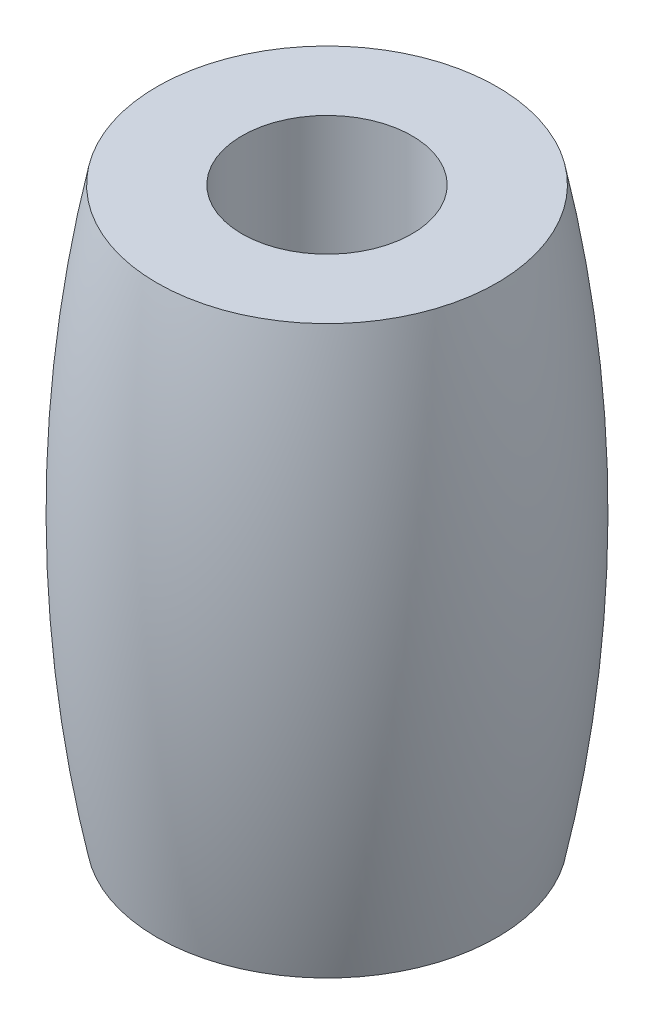
from build123d import *

# Parameters (mm, degrees)
SKETCH3_R          = 1.5
CUT_EXTRUDE1_DEPTH = 12.161159952


with BuildPart() as part:
    # Sketch2 → Revolve1 (revolve)
    with BuildSketch(Plane.XY, mode=Mode.PRIVATE) as revolve1_sk:
        with BuildLine():
            Line((0, 0), (3, 0))
            ThreePointArc((3, 0), (3.505102572, 5), (3, 10))
            Line((3, 10), (0, 10))
            Line((0, 10), (0, 0))
        make_face()
    revolve(revolve1_sk.sketch.rotate(Axis((0, 10, 0), (0, -1, 0)), 90), axis=Axis((0, 10, 0), (0, -1, 0)))

    # Sketch3 → Cut-Extrude1 (cut, through all)
    with BuildSketch(Plane(origin=(0, 10, 0), x_dir=(1, 0, 0), z_dir=(0, 1, 0))):
        with Locations(Location((0, 0, 0), (0, 0, 270))):
            Circle(SKETCH3_R)
    extrude(amount=-CUT_EXTRUDE1_DEPTH, mode=Mode.SUBTRACT)


solid = part.part
